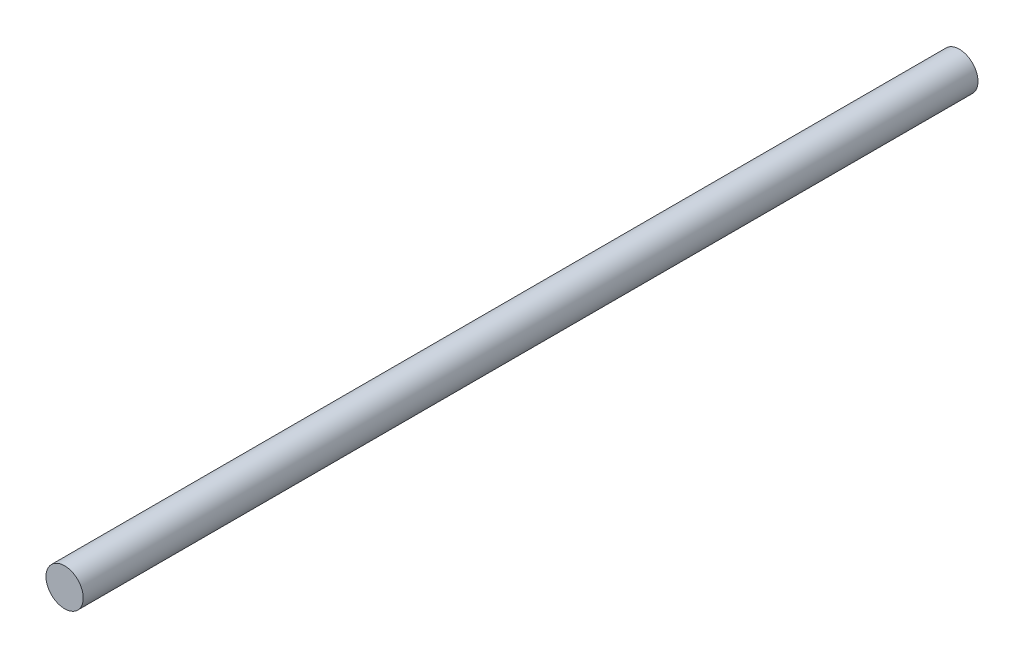
from build123d import *

# Parameters (mm, degrees)
SKETCH1_R              = 2.5
KABLO_24V_D5X120_DEPTH = 120


with BuildPart() as part:
    # Sketch1 → KABLO_24V_D5x120 (new body)
    with BuildSketch(Plane.XY):
        Circle(SKETCH1_R)
    extrude(amount=-KABLO_24V_D5X120_DEPTH)


solid = part.part
